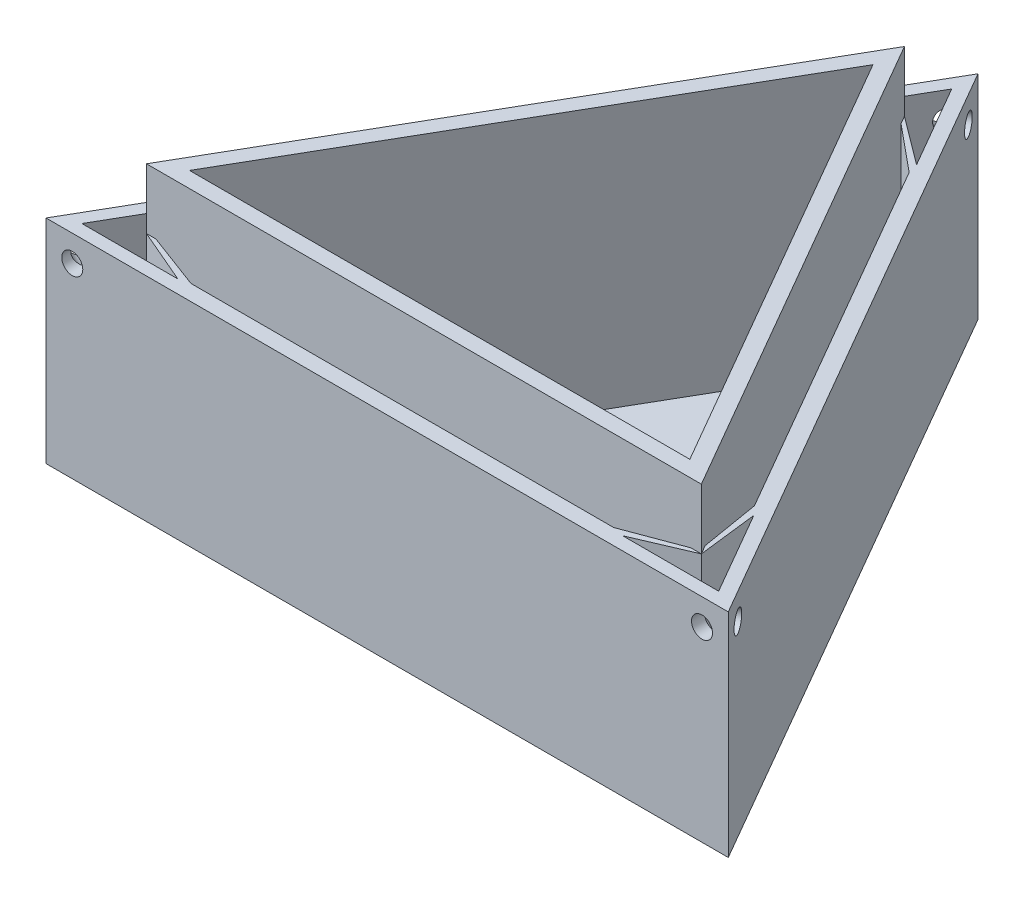
from build123d import *

# Parameters (mm, degrees)
BOSS_EXTRUDE1_DEPTH            = 40.5
BOSS_EXTRUDE2_DEPTH            = 11.5
CUT_EXTRUDE1_DEPTH             = 38.5
CUT_EXTRUDE2_DEPTH             = 38.5
CUT_EXTRUDE3_DEPTH             = 38.5
CUT_EXTRUDE4_DEPTH             = 38.5
CUT_EXTRUDE5_DEPTH             = 38.5
CUT_EXTRUDE6_DEPTH             = 38.5
CUT_EXTRUDE7_DEPTH             = 50
F_18_0_18_DIAMETER_HOLE1_D     = 18
F_18_0_18_DIAMETER_HOLE1_DEPTH = 52
F_2_45_2_45_DIAMETER_HOLE1_D   = 2.45
F_4_0_4_DIAMETER_HOLE1_D       = 4
F_4_0_4_DIAMETER_HOLE1_DEPTH   = 3
F_4_0_4_DIAMETER_HOLE2_D       = 4
F_4_0_4_DIAMETER_HOLE2_DEPTH   = 3
F_4_0_4_DIAMETER_HOLE3_D       = 4
F_4_0_4_DIAMETER_HOLE3_DEPTH   = 3


with BuildPart() as part:
    # Sketch1 → Boss-Extrude1 (new body)
    with BuildSketch(Plane.XZ.offset(0.5)):
        Polygon((64.951905284, 37.5), (-64.951905284, 37.5), (0, -75), align=None)
    extrude(amount=-BOSS_EXTRUDE1_DEPTH)

    # Sketch4 → Boss-Extrude2 (add)
    with BuildSketch(Plane(origin=(0, 40, 0), x_dir=(-1, 0, 0), z_dir=(0, 1, 0))):
        Polygon((0, -61), (-52.827549631, 30.5), (52.827549631, 30.5), align=None)
    extrude(amount=BOSS_EXTRUDE2_DEPTH)

    # Sketch2 → Cut-Extrude1 (cut)
    with BuildSketch(Plane(origin=(0, 40, 0), x_dir=(-1, 0, 0), z_dir=(0, 1, 0))):
        Polygon((-0.899647383, -59.441765024), (-51.827549631, 28.767949192), (-49.94764189, 17.511853471), (-9.707758354, -52.185669302), align=None)
    extrude(amount=-CUT_EXTRUDE1_DEPTH, mode=Mode.SUBTRACT)

    # Sketch3 → Cut-Extrude2 (cut)
    with BuildSketch(Plane(origin=(0, 40, 0), x_dir=(-1, 0, 0), z_dir=(0, 1, 0))):
        Polygon((-50.827549631, 30.5), (51.028254843, 30.5), (40.340234991, 34.5), (-40.139530918, 34.5), align=None)
    extrude(amount=-CUT_EXTRUDE2_DEPTH, mode=Mode.SUBTRACT)

    # Sketch5 → Cut-Extrude3 (cut)
    with BuildSketch(Plane(origin=(0, 40, 0), x_dir=(-1, 0, 0), z_dir=(0, 1, 0))):
        Polygon((50.047994507, 17.685669302), (51.827549631, 28.767949192), (1, -59.267949192), (9.707758354, -52.185669302), align=None)
    extrude(amount=-CUT_EXTRUDE3_DEPTH, mode=Mode.SUBTRACT)

    # Sketch6 → Cut-Extrude4 (cut)
    with BuildSketch(Plane(origin=(0, 40, 0), x_dir=(-1, 0, 0), z_dir=(0, 1, 0))):
        Polygon((-42.340236152, 35), (-60.621778265, 35), (-51.481007209, 19.16772011), (-52.827549631, 30.5), align=None)
    extrude(amount=-CUT_EXTRUDE4_DEPTH, mode=Mode.SUBTRACT)

    # Sketch7 → Cut-Extrude5 (cut)
    with BuildSketch(Plane(origin=(0, 40, 0), x_dir=(-1, 0, 0), z_dir=(0, 1, 0))):
        Polygon((60.621778265, 35), (51.481007209, 19.16772011), (52.827549631, 30.5), (42.340234991, 35), align=None)
    extrude(amount=-CUT_EXTRUDE5_DEPTH, mode=Mode.SUBTRACT)

    # Sketch8 → Cut-Extrude6 (cut)
    with BuildSketch(Plane(origin=(0, 40, 0), x_dir=(-1, 0, 0), z_dir=(0, 1, 0))):
        Polygon((0, -70), (-9.140771056, -54.16772011), (0, -61), (9.140771056, -54.16772011), align=None)
    extrude(amount=-CUT_EXTRUDE6_DEPTH, mode=Mode.SUBTRACT)

    # Sketch9 → Cut-Extrude7 (cut)
    with BuildSketch(Plane(origin=(0, 51.5, 0), x_dir=(-1, 0, 0), z_dir=(0, 1, 0))):
        Polygon((47.631397208, 27.5), (-47.631397208, 27.5), (0, -55), align=None)
    extrude(amount=-CUT_EXTRUDE7_DEPTH, mode=Mode.SUBTRACT)

    # Ø18.0 (18) Diameter Hole1
    with Locations(Plane(origin=(0, -0.5, 0), x_dir=(-1, 0, 0), z_dir=(0, -1, 0))):
        with Locations((0, 0)):
            Hole(F_18_0_18_DIAMETER_HOLE1_D / 2, depth=F_18_0_18_DIAMETER_HOLE1_DEPTH)

    # Ø2.45 (2.45) Diameter Hole1 (through all)
    with Locations(Plane(origin=(0, 1.5, 0), x_dir=(1, 0, 0), z_dir=(0, 1, 0))):
        with Locations((13.95, 13.95), (-13.95, -13.95), (13.95, -13.95), (-13.95, 13.95)):
            Hole(F_2_45_2_45_DIAMETER_HOLE1_D / 2)

    # Ø4.0 (4) Diameter Hole1
    with Locations(Plane.XY.offset(37.5)):
        with Locations((59.951905284, 35), (-59.951905284, 35)):
            Hole(F_4_0_4_DIAMETER_HOLE1_D / 2, depth=F_4_0_4_DIAMETER_HOLE1_DEPTH)

    # Ø4.0 (4) Diameter Hole2
    with Locations(Plane(origin=(-32.475952642, 0, -18.75), x_dir=(-0.5000000000000003, 0, 0.8660254037844385), z_dir=(-0.8660254037844385, 0, -0.5000000000000003))):
        with Locations((-59.951905284, 35), (59.951905284, 35)):
            Hole(F_4_0_4_DIAMETER_HOLE2_D / 2, depth=F_4_0_4_DIAMETER_HOLE2_DEPTH)

    # Ø4.0 (4) Diameter Hole3
    with Locations(Plane(origin=(32.475952642, 0, -18.75), x_dir=(-0.499999999999999, 0, -0.8660254037844394), z_dir=(0.8660254037844394, 0, -0.499999999999999))):
        with Locations((59.951905284, 35), (-59.951905284, 35)):
            Hole(F_4_0_4_DIAMETER_HOLE3_D / 2, depth=F_4_0_4_DIAMETER_HOLE3_DEPTH)


solid = part.part
